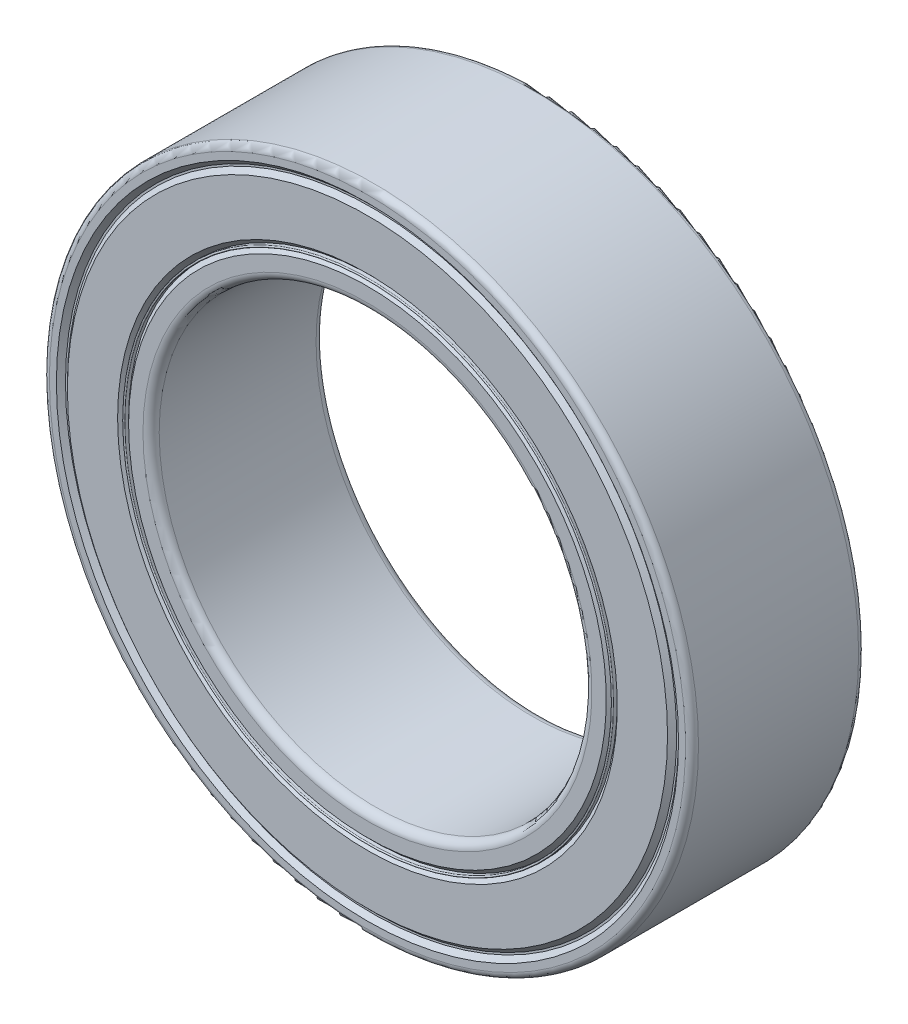
from build123d import *

# Parameters (mm, degrees)
SKETCH3_W         = 4
SKETCH3_H         = 0.416666667
SKETCH3_H_2       = 0.625
SKETCH4_R         = 0.875
CIRPATTERN1_COUNT = 15
FILLET1_R         = 0.15
FILLET2_R         = 0.1875
CHAMFER1_SIZE     = 0.105
CHAMFER2_SIZE     = 0.105


with BuildPart() as part:
    # Sketch3 → Revolve1 (revolve)
    with BuildSketch(Plane(origin=(0, 0, 0), x_dir=(0, 0, -1), z_dir=(1, 0, 0)), mode=Mode.PRIVATE) as revolve1_sk:
        with Locations((0, -7.291666667)):
            Rectangle(SKETCH3_W, SKETCH3_H)
        with Locations((0, -5.3125)):
            Rectangle(SKETCH3_W, SKETCH3_H_2)
    revolve(revolve1_sk.sketch.rotate(Axis((0, 0, -2), (0, 0, 1)), 270), axis=Axis((0, 0, -2), (0, 0, 1)))

    # Sketch4 → Cut-Revolve1 (revolve, cut)
    with BuildSketch(Plane(origin=(0, 0, 0), x_dir=(0, 0, -1), z_dir=(1, 0, 0)), mode=Mode.PRIVATE) as cut_revolve1_sk:
        with Locations((0, -6.354166667)):
            Circle(SKETCH4_R)
    revolve(cut_revolve1_sk.sketch.rotate(Axis((0, 0, -2), (0, 0, 1)), 270), axis=Axis((0, 0, -2), (0, 0, 1)), mode=Mode.SUBTRACT)

    # Fillet1
    fillet1_edges = [part.edges().sort_by_distance(p)[0] for p in [
        (7.5, 0, -2),
        (7.5, 0, 2),
    ]]
    fillet(fillet1_edges, radius=FILLET1_R)

    # Fillet2
    fillet2_edges = [part.edges().sort_by_distance(p)[0] for p in [
        (5, 0, -2),
        (5, 0, 2),
    ]]
    fillet(fillet2_edges, radius=FILLET2_R)

    # Chamfer1
    chamfer1_edges = [part.edges().sort_by_distance(p)[0] for p in [
        (7.083333333, 0, 2),
        (7.083333333, 0, -2),
    ]]
    chamfer(chamfer1_edges, length=CHAMFER1_SIZE)

    # Chamfer2
    chamfer2_edges = [part.edges().sort_by_distance(p)[0] for p in [
        (5.625, 0, 2),
        (5.625, 0, -2),
    ]]
    chamfer(chamfer2_edges, length=CHAMFER2_SIZE)


with BuildPart() as body_2:
    # Sketch5 → Revolve2 (revolve)
    with BuildSketch(Plane(origin=(0, 0, 0), x_dir=(0, 0, -1), z_dir=(1, 0, 0))):
        with BuildLine():
            Line((0, -5.479166667), (0, -7.229166667))
            ThreePointArc((0, -7.229166667), (0.875, -6.354166667), (0, -5.479166667))
        make_face()
    revolve(axis=Axis((0, -5.479166667, 0), (0, -1, 0)))


with BuildPart() as cirpattern1_1:
    # CirPattern1: pattern copy
    add(body_2.part.rotate(Axis((0, 0, 0), (0, 0, 1)), 1 * 360 / CIRPATTERN1_COUNT))


with BuildPart() as cirpattern1_2:
    # CirPattern1: pattern copy
    add(body_2.part.rotate(Axis((0, 0, 0), (0, 0, 1)), 2 * 360 / CIRPATTERN1_COUNT))


with BuildPart() as cirpattern1_3:
    # CirPattern1: pattern copy
    add(body_2.part.rotate(Axis((0, 0, 0), (0, 0, 1)), 3 * 360 / CIRPATTERN1_COUNT))


with BuildPart() as cirpattern1_4:
    # CirPattern1: pattern copy
    add(body_2.part.rotate(Axis((0, 0, 0), (0, 0, 1)), 4 * 360 / CIRPATTERN1_COUNT))


with BuildPart() as cirpattern1_5:
    # CirPattern1: pattern copy
    add(body_2.part.rotate(Axis((0, 0, 0), (0, 0, 1)), 5 * 360 / CIRPATTERN1_COUNT))


with BuildPart() as cirpattern1_6:
    # CirPattern1: pattern copy
    add(body_2.part.rotate(Axis((0, 0, 0), (0, 0, 1)), 6 * 360 / CIRPATTERN1_COUNT))


with BuildPart() as cirpattern1_7:
    # CirPattern1: pattern copy
    add(body_2.part.rotate(Axis((0, 0, 0), (0, 0, 1)), 7 * 360 / CIRPATTERN1_COUNT))


with BuildPart() as cirpattern1_8:
    # CirPattern1: pattern copy
    add(body_2.part.rotate(Axis((0, 0, 0), (0, 0, 1)), 8 * 360 / CIRPATTERN1_COUNT))


with BuildPart() as cirpattern1_9:
    # CirPattern1: pattern copy
    add(body_2.part.rotate(Axis((0, 0, 0), (0, 0, 1)), 9 * 360 / CIRPATTERN1_COUNT))


with BuildPart() as cirpattern1_10:
    # CirPattern1: pattern copy
    add(body_2.part.rotate(Axis((0, 0, 0), (0, 0, 1)), 10 * 360 / CIRPATTERN1_COUNT))


with BuildPart() as cirpattern1_11:
    # CirPattern1: pattern copy
    add(body_2.part.rotate(Axis((0, 0, 0), (0, 0, 1)), 11 * 360 / CIRPATTERN1_COUNT))


with BuildPart() as cirpattern1_12:
    # CirPattern1: pattern copy
    add(body_2.part.rotate(Axis((0, 0, 0), (0, 0, 1)), 12 * 360 / CIRPATTERN1_COUNT))


with BuildPart() as cirpattern1_13:
    # CirPattern1: pattern copy
    add(body_2.part.rotate(Axis((0, 0, 0), (0, 0, 1)), 13 * 360 / CIRPATTERN1_COUNT))


with BuildPart() as cirpattern1_14:
    # CirPattern1: pattern copy
    add(body_2.part.rotate(Axis((0, 0, 0), (0, 0, 1)), 14 * 360 / CIRPATTERN1_COUNT))


with BuildPart() as body_17:
    # Sketch6 → Revolve3 (revolve)
    with BuildSketch(Plane(origin=(0, 0, 0), x_dir=(0, 0, -1), z_dir=(1, 0, 0)), mode=Mode.PRIVATE) as revolve3_sk:
        Polygon((-2, -5.77375), (-2, -6.934583333), (-1.895, -7.039583333), (-1.895, -7.083333333), (-0.875, -7.083333333), (-0.875, -5.625), (-1.895, -5.625), (-1.895, -5.66875), align=None)
        Polygon((1.895, -7.083333333), (0.875, -7.083333333), (0.875, -5.625), (1.895, -5.625), (1.895, -5.66875), (2, -5.77375), (2, -6.934583333), (1.895, -7.039583333), align=None)
    revolve(revolve3_sk.sketch.rotate(Axis((0, 0, -2), (0, 0, 1)), 270), axis=Axis((0, 0, -2), (0, 0, 1)))


with BuildPart() as body_18:
    # Sketch7 → Revolve4 (revolve)
    with BuildSketch(Plane(origin=(0, 0, 0), x_dir=(0, 0, -1), z_dir=(1, 0, 0)), mode=Mode.PRIVATE) as revolve4_sk:
        with BuildLine():
            Line((-1.895, -5.66875), (-1.895, -5.625))
            Line((-1.895, -5.625), (-1.978125, -5.625))
            ThreePointArc((-1.978125, -5.625), (-2, -5.646875), (-1.978125, -5.66875))
            Line((-1.978125, -5.66875), (-1.895, -5.66875))
        make_face()
        with BuildLine():
            Line((1.895, -5.625), (1.978125, -5.625))
            ThreePointArc((1.978125, -5.625), (2, -5.646875), (1.978125, -5.66875))
            Line((1.978125, -5.66875), (1.895, -5.66875))
            Line((1.895, -5.66875), (1.895, -5.625))
        make_face()
    revolve(revolve4_sk.sketch.rotate(Axis((0, 0, -2), (0, 0, 1)), 270), axis=Axis((0, 0, -2), (0, 0, 1)))


solid = Compound([part.part, body_2.part, cirpattern1_1.part, cirpattern1_2.part, cirpattern1_3.part, cirpattern1_4.part, cirpattern1_5.part, cirpattern1_6.part, cirpattern1_7.part, cirpattern1_8.part, cirpattern1_9.part, cirpattern1_10.part, cirpattern1_11.part, cirpattern1_12.part, cirpattern1_13.part, cirpattern1_14.part, body_17.part, body_18.part])
